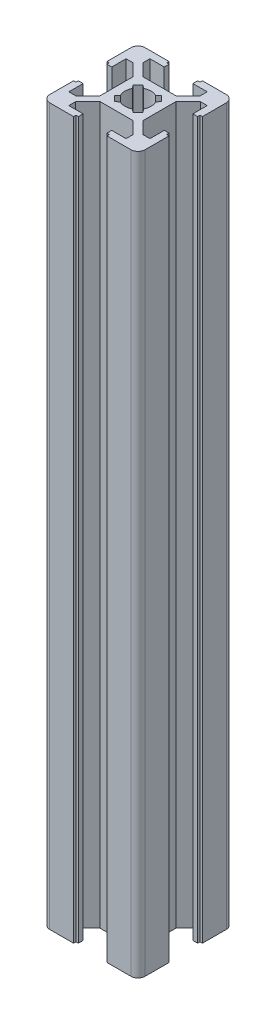
from build123d import *

# Parameters (mm, degrees)
DODANIE_WYCI_GNI_CIE1_DEPTH = 150


with BuildPart() as part:
    # Szkic1 → Dodanie-wyciągnięcie1 (new body)
    # profile 1 of 5: a face of its own
    with BuildSketch(Plane(origin=(0, 0, 0), x_dir=(1, 0, 0), z_dir=(0, 1, 0))):
        with BuildLine():
            Line((-7.06, 6), (-4.5, 3.440546933))
            Line((-4.5, 3.440546933), (-4.5, 4.5))
            Line((-4.5, 4.5), (-3.440546933, 4.5))
            Line((-3.440546933, 4.5), (-6, 7.06))
            Line((-6, 7.06), (-6, 8.5))
            Line((-6, 8.5), (-3, 8.5))
            Line((-3, 8.5), (-3, 9.5))
            Line((-3, 9.5), (-3.5, 9.5))
            Line((-3.5, 9.5), (-3.5, 10))
            Line((-3.5, 10), (-8.5, 10))
            ThreePointArc((-8.5, 10), (-9.560660172, 9.560660172), (-10, 8.5))
            Line((-10, 8.5), (-10, 3.5))
            Line((-10, 3.5), (-9.5, 3.5))
            Line((-9.5, 3.5), (-9.5, 3))
            Line((-9.5, 3), (-8.5, 3))
            Line((-8.5, 3), (-8.5, 6))
            Line((-8.5, 6), (-7.06, 6))
        make_face()
    # profile 2 of 5: a face of its own
    with BuildSketch(Plane(origin=(0, 0, 0), x_dir=(1, 0, 0), z_dir=(0, 1, 0))):
        with BuildLine():
            Line((4.5, 4.5), (4.5, 3.440546933))
            Line((4.5, 3.440546933), (7.06, 6))
            Line((7.06, 6), (8.5, 6))
            Line((8.5, 6), (8.5, 3))
            Line((8.5, 3), (9.5, 3))
            Line((9.5, 3), (9.5, 3.5))
            Line((9.5, 3.5), (10, 3.5))
            Line((10, 3.5), (10, 8.5))
            ThreePointArc((10, 8.5), (9.560660172, 9.560660172), (8.5, 10))
            Line((8.5, 10), (3.5, 10))
            Line((3.5, 10), (3.5, 9.5))
            Line((3.5, 9.5), (3, 9.5))
            Line((3, 9.5), (3, 8.5))
            Line((3, 8.5), (6, 8.5))
            Line((6, 8.5), (6, 7.06))
            Line((6, 7.06), (3.440546933, 4.5))
            Line((3.440546933, 4.5), (4.5, 4.5))
        make_face()
    # profile 3 of 5: a face of its own
    with BuildSketch(Plane(origin=(0, 0, 0), x_dir=(1, 0, 0), z_dir=(0, 1, 0))):
        Polygon((3.440546933, -4.5), (4.5, -4.5), (4.5, -3.440546933), (4.5, 3.440546933), (4.5, 4.5), (3.440546933, 4.5), (-3.440546933, 4.5), (-4.5, 4.5), (-4.5, 3.440546933), (-4.5, -3.440546933), (-4.5, -4.5), (-3.440546933, -4.5), align=None)
        with BuildLine():
            Line((-3.00520382, 1.944543648), (-1.944543648, 3.00520382))
            Line((-1.944543648, 3.00520382), (-1.271309214, 2.438498079))
            ThreePointArc((-1.271309214, 2.438498079), (0, 2.75), (1.271309214, 2.438498079))
            Line((1.271309214, 2.438498079), (1.944543648, 3.00520382))
            Line((1.944543648, 3.00520382), (3.00520382, 1.944543648))
            Line((3.00520382, 1.944543648), (2.438498079, 1.271309214))
            ThreePointArc((2.438498079, 1.271309214), (2.670989491, 0.654457899), (2.75, 0))
            ThreePointArc((2.75, 0), (2.670989491, -0.654457899), (2.438498079, -1.271309214))
            Line((2.438498079, -1.271309214), (3.00520382, -1.944543648))
            Line((3.00520382, -1.944543648), (1.944543648, -3.00520382))
            Line((1.944543648, -3.00520382), (1.271309214, -2.438498079))
            ThreePointArc((1.271309214, -2.438498079), (0, -2.75), (-1.271309214, -2.438498079))
            Line((-1.271309214, -2.438498079), (-1.944543648, -3.00520382))
            Line((-1.944543648, -3.00520382), (-3.00520382, -1.944543648))
            Line((-3.00520382, -1.944543648), (-2.438498079, -1.271309214))
            ThreePointArc((-2.438498079, -1.271309214), (-2.75, 0), (-2.438498079, 1.271309214))
            Line((-2.438498079, 1.271309214), (-3.00520382, 1.944543648))
        make_face(mode=Mode.SUBTRACT)
    # profile 4 of 5: a face of its own
    with BuildSketch(Plane(origin=(0, 0, 0), x_dir=(1, 0, 0), z_dir=(0, 1, 0))):
        with BuildLine():
            Line((-6, -7.06), (-3.440546933, -4.5))
            Line((-3.440546933, -4.5), (-4.5, -4.5))
            Line((-4.5, -4.5), (-4.5, -3.440546933))
            Line((-4.5, -3.440546933), (-7.06, -6))
            Line((-7.06, -6), (-8.5, -6))
            Line((-8.5, -6), (-8.5, -3))
            Line((-8.5, -3), (-9.5, -3))
            Line((-9.5, -3), (-9.5, -3.5))
            Line((-9.5, -3.5), (-10, -3.5))
            Line((-10, -3.5), (-10, -8.5))
            ThreePointArc((-10, -8.5), (-9.560660172, -9.560660172), (-8.5, -10))
            Line((-8.5, -10), (-3.5, -10))
            Line((-3.5, -10), (-3.5, -9.5))
            Line((-3.5, -9.5), (-3, -9.5))
            Line((-3, -9.5), (-3, -8.5))
            Line((-3, -8.5), (-6, -8.5))
            Line((-6, -8.5), (-6, -7.06))
        make_face()
    # profile 5 of 5: a face of its own
    with BuildSketch(Plane(origin=(0, 0, 0), x_dir=(1, 0, 0), z_dir=(0, 1, 0))):
        with BuildLine():
            Line((4.5, -3.440546933), (4.5, -4.5))
            Line((4.5, -4.5), (3.440546933, -4.5))
            Line((3.440546933, -4.5), (6, -7.06))
            Line((6, -7.06), (6, -8.5))
            Line((6, -8.5), (3, -8.5))
            Line((3, -8.5), (3, -9.5))
            Line((3, -9.5), (3.5, -9.5))
            Line((3.5, -9.5), (3.5, -10))
            Line((3.5, -10), (8.5, -10))
            ThreePointArc((8.5, -10), (9.560660172, -9.560660172), (10, -8.5))
            Line((10, -8.5), (10, -3.5))
            Line((10, -3.5), (9.5, -3.5))
            Line((9.5, -3.5), (9.5, -3))
            Line((9.5, -3), (8.5, -3))
            Line((8.5, -3), (8.5, -6))
            Line((8.5, -6), (7.06, -6))
            Line((7.06, -6), (4.5, -3.440546933))
        make_face()
    extrude(amount=DODANIE_WYCI_GNI_CIE1_DEPTH)


solid = part.part
